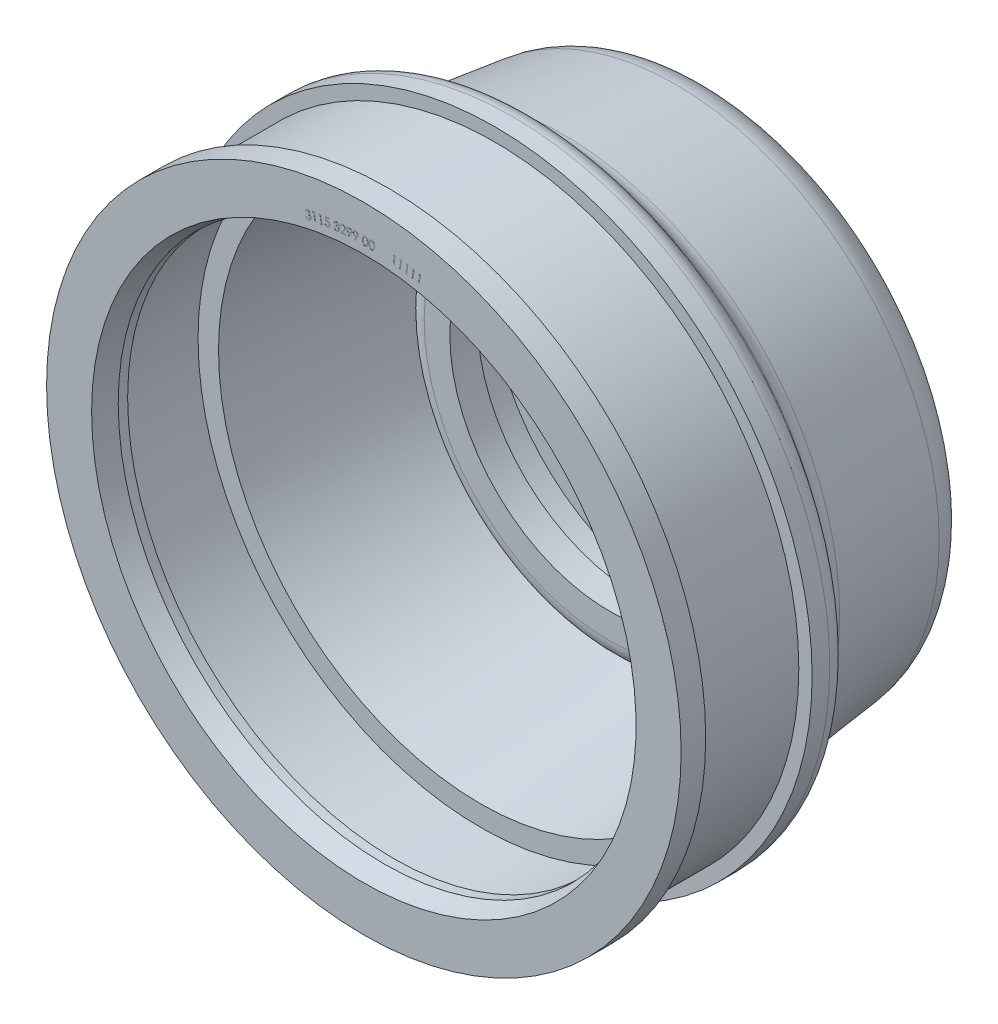
from build123d import *

# Parameters (mm, degrees)
CUT_EXTRUDE1_DEPTH = 0.01


with BuildPart() as part:
    # Sketch1 → Revolve1 (revolve)
    with BuildSketch(Plane(origin=(0, 0, 0), x_dir=(0, 0, -1), z_dir=(1, 0, 0)), mode=Mode.PRIVATE) as revolve1_sk:
        with BuildLine():
            Line((0, 39), (0, 54.394051802))
            ThreePointArc((0, 54.394051802), (-2.513674308, 61.023903054), (-8.790985526, 64.320696955))
            Line((-8.790985526, 64.320696955), (-36.478114058, 67.692847225))
            ThreePointArc((-36.478114058, 67.692847225), (-38.742988773, 68.447084113), (-40.534523991, 70.024719154))
            Line((-40.534523991, 70.024719154), (-44.699441155, 75.520095969))
            ThreePointArc((-44.699441155, 75.520095969), (-46.459484376, 76.977749426), (-48.684290003, 77.5))
            Line((-48.684290003, 77.5), (-53, 77.5))
            Line((-53, 77.5), (-53, 74.25))
            Line((-53, 74.25), (-79, 74.25))
            Line((-79, 74.25), (-79, 77.5))
            Line((-79, 77.5), (-85, 77.5))
            Line((-85, 77.5), (-85, 66.5))
            Line((-85, 66.5), (-80, 65))
            Line((-80, 65), (-77.7, 65))
            Line((-77.7, 65), (-77.7, 69))
            Line((-77.7, 69), (-56.5, 69))
            Line((-56.5, 69), (-56.5, 64))
            Line((-56.5, 64), (-12.052985352, 58.864920289))
            ThreePointArc((-12.052985352, 58.864920289), (-9.513981986, 56.283640543), (-11.498588097, 53.255294162))
            Line((-11.498588097, 53.255294162), (-21.5350139, 50.017737452))
            ThreePointArc((-21.5350139, 50.017737452), (-24.041971641, 48.20240099), (-25, 45.259194363))
            Line((-25, 45.259194363), (-25, 39))
            Line((-25, 39), (-18.3, 39))
            Line((-18.3, 39), (-18.3, 46))
            Line((-18.3, 46), (-8.2, 46))
            Line((-8.2, 46), (-8.2, 39))
            Line((-8.2, 39), (0, 39))
        make_face()
    revolve(revolve1_sk.sketch.rotate(Axis((0, 0, 0), (0, 0, 1)), 90), axis=Axis((0, 0, 0), (0, 0, 1)))

    # Sketch2 → Cut-Extrude1 (cut)
    # profile 1 of 15: a face of its own
    with BuildSketch(Plane.XY.offset(85)):
        with BuildLine():
            Line((-14.070038677, 68.536967028), (-14.269157267, 68.497303567))
            add(Edge.make_bspline(
                [(-14.269157267, 68.497303567), (-14.268217033, 68.517888074), (-14.26637414, 68.558234467), (-14.259236627, 68.617192032), (-14.247861138, 68.673247785), (-14.233204234, 68.726476158), (-14.21474788, 68.776942803), (-14.192256969, 68.824444023), (-14.165681269, 68.869007068), (-14.13563636, 68.910685567), (-14.102537905, 68.949053015), (-14.066490716, 68.983784232), (-14.028157999, 69.015069184), (-13.987041034, 69.042571359), (-13.943142971, 69.065729532), (-13.89690089, 69.085379921), (-13.848164356, 69.101679419), (-13.81437471, 69.109244233), (-13.797202139, 69.113088823)],
                knots=[0, 0, 0, 0, 1.170908619, 2.295024069, 3.371275982, 4.419129459, 5.43012897, 6.421534669, 7.401748581, 8.375002166, 9.338259363, 10.277655465, 11.216530114, 12.147021787, 13.084207398, 14.033031717, 15.000347516, 16, 16, 16, 16], degree=3))
            add(Edge.make_bspline(
                [(-13.797202139, 69.113088823), (-13.772031836, 69.117393698), (-13.722204708, 69.125915628), (-13.646496655, 69.126368418), (-13.571614446, 69.119245356), (-13.498626538, 69.10153163), (-13.428718471, 69.07702812), (-13.364620479, 69.043357094), (-13.306515138, 69.002720758), (-13.25602053, 68.954410284), (-13.212208141, 68.901663911), (-13.177712654, 68.84449306), (-13.150554539, 68.784661278), (-13.14042546, 68.742444361), (-13.135343164, 68.7212619)],
                knots=[0, 0, 0, 0, 1.075806183, 2.129665784, 3.183208981, 4.242477957, 5.290536784, 6.301210102, 7.287717869, 8.272276444, 9.241247785, 10.171891763, 11.082741347, 12, 12, 12, 12], degree=3))
            add(Edge.make_bspline(
                [(-13.135343164, 68.7212619), (-13.131959387, 68.700622745), (-13.125308999, 68.660059093), (-13.125401684, 68.59884041), (-13.134499619, 68.539452143), (-13.15121013, 68.481528016), (-13.177489478, 68.425772757), (-13.211937501, 68.371679452), (-13.254987335, 68.319449524), (-13.288688143, 68.287678091), (-13.306016241, 68.271342028)],
                knots=[0, 0, 0, 0, 0.991178882, 1.948036904, 2.889921948, 3.834361493, 4.798306442, 5.803864247, 6.870802846, 8, 8, 8, 8], degree=3))
            add(Edge.make_bspline(
                [(-13.306016241, 68.271342028), (-13.281406993, 68.265791342), (-13.232939155, 68.254859283), (-13.16383868, 68.228361552), (-13.099520396, 68.19409772), (-13.061136275, 68.16490639), (-13.041993805, 68.150348438)],
                knots=[0, 0, 0, 0, 1.030779272, 2.030116544, 3.01760328, 4, 4, 4, 4], degree=3))
            add(Edge.make_bspline(
                [(-13.041993805, 68.150348438), (-13.029259118, 68.139463358), (-13.004099632, 68.117958078), (-12.969953435, 68.08262251), (-12.939881983, 68.044976477), (-12.912682471, 68.005978309), (-12.890434137, 67.964156245), (-12.870939177, 67.920951955), (-12.855634877, 67.875418194), (-12.848486603, 67.844060996), (-12.844878421, 67.828233054)],
                knots=[0, 0, 0, 0, 1.042724602, 2.060075301, 3.053527876, 4.040661669, 5.015531578, 5.998277854, 6.989605394, 8, 8, 8, 8], degree=3))
            add(Edge.make_bspline(
                [(-12.844878421, 67.828233054), (-12.840489729, 67.800662064), (-12.831728136, 67.745619277), (-12.832631668, 67.661370611), (-12.844870059, 67.576980592), (-12.864255819, 67.507434805), (-12.884712487, 67.452900115), (-12.902988829, 67.413585502), (-12.922872388, 67.375593156), (-12.945895292, 67.339601979), (-12.971018153, 67.305065749), (-12.998901252, 67.272543997), (-13.02887619, 67.241611739), (-13.072268545, 67.203232344), (-13.131326273, 67.1601308), (-13.209296015, 67.118070195), (-13.293703452, 67.08450555), (-13.353334922, 67.070533559), (-13.3837406, 67.063409336)],
                knots=[0, 0, 0, 0, 1.284125756, 2.56363157, 3.862451106, 5.202609335, 5.880101551, 6.543455158, 7.198398646, 7.853717567, 8.509498265, 9.164037199, 9.825248231, 10.491902125, 11.830591315, 13.182136447, 14.563190635, 16, 16, 16, 16], degree=3))
            add(Edge.make_bspline(
                [(-13.3837406, 67.063409336), (-13.404390996, 67.059706478), (-13.444964815, 67.052431116), (-13.505717907, 67.047916387), (-13.564674213, 67.047638809), (-13.621968263, 67.052840578), (-13.677441707, 67.063399129), (-13.73144824, 67.078540771), (-13.783558457, 67.099130729), (-13.833971898, 67.124410845), (-13.8819649, 67.154930077), (-13.927587603, 67.190194535), (-13.969641682, 67.231204717), (-14.009579475, 67.276542826), (-14.046334302, 67.327257072), (-14.080369081, 67.382753343), (-14.111901247, 67.443057232), (-14.129783121, 67.485807491), (-14.138948934, 67.507720233)],
                knots=[0, 0, 0, 0, 1.045142002, 2.053491, 3.032043598, 3.981265106, 4.916068531, 5.843256323, 6.772854538, 7.704666736, 8.650216465, 9.603630256, 10.573472105, 11.573547216, 12.612096538, 13.691014964, 14.816470499, 16, 16, 16, 16], degree=3))
            Line((-14.138948934, 67.507720233), (-13.947843164, 67.545781131))
            add(Edge.make_bspline(
                [(-13.947843164, 67.545781131), (-13.940530618, 67.531267743), (-13.926321262, 67.503066091), (-13.902905514, 67.463514733), (-13.879454815, 67.427059371), (-13.854526117, 67.394746927), (-13.829199524, 67.365609176), (-13.803354949, 67.340006454), (-13.776629004, 67.317827187), (-13.75767073, 67.305744526), (-13.748323934, 67.299787541)],
                knots=[0, 0, 0, 0, 1.214869046, 2.360669634, 3.435331008, 4.453968487, 5.409357715, 6.320290578, 7.171870756, 8, 8, 8, 8], degree=3))
            add(Edge.make_bspline(
                [(-13.748323934, 67.299787541), (-13.736289028, 67.293263338), (-13.712340289, 67.280280568), (-13.674399266, 67.265249265), (-13.635381084, 67.253164094), (-13.594546643, 67.24643432), (-13.55251438, 67.242093456), (-13.509072109, 67.242421643), (-13.464272974, 67.2457826), (-13.434316583, 67.251295295), (-13.418997011, 67.254114464)],
                knots=[0, 0, 0, 0, 0.965045928, 1.920383362, 2.874325804, 3.840980334, 4.834806091, 5.852422248, 6.901737782, 8, 8, 8, 8], degree=3))
            add(Edge.make_bspline(
                [(-13.418997011, 67.254114464), (-13.401836341, 67.257993508), (-13.368234518, 67.265588953), (-13.320001091, 67.28115476), (-13.27533227, 67.300588653), (-13.233772318, 67.322857219), (-13.195865464, 67.349198106), (-13.161172974, 67.378835767), (-13.130311067, 67.412419729), (-13.102752698, 67.448616372), (-13.079367046, 67.487049298), (-13.059462953, 67.526135425), (-13.044612079, 67.566277552), (-13.033824523, 67.606789383), (-13.026654464, 67.647813734), (-13.025026083, 67.689474461), (-13.026657945, 67.731662145), (-13.031524068, 67.759626569), (-13.033980985, 67.773745874)],
                knots=[0, 0, 0, 0, 1.169020315, 2.289025614, 3.362478143, 4.403134348, 5.417566769, 6.424632741, 7.429584096, 8.443278395, 9.443475207, 10.416034277, 11.354160968, 12.282154581, 13.200032008, 14.115373679, 15.048447587, 16, 16, 16, 16], degree=3))
            add(Edge.make_bspline(
                [(-13.033980985, 67.773745874), (-13.038507972, 67.792348209), (-13.047524339, 67.829398336), (-13.070875514, 67.881996177), (-13.102108954, 67.930855391), (-13.14053204, 67.975515248), (-13.184781696, 68.014887946), (-13.233525949, 68.048351317), (-13.287044454, 68.073609288), (-13.334918483, 68.088688675), (-13.376284876, 68.097415248), (-13.411185233, 68.100967388), (-13.449401971, 68.103514723), (-13.49113111, 68.103792419), (-13.536282822, 68.101982232), (-13.584960439, 68.098990442), (-13.637014866, 68.093071768), (-13.672878374, 68.088309214), (-13.691432908, 68.085845233)],
                knots=[0, 0, 0, 0, 1.123859295, 2.238381966, 3.36448805, 4.522709502, 5.690525319, 6.838186276, 7.986599023, 9.156181961, 9.781364425, 10.468957554, 11.216352615, 12.03296427, 12.920758923, 13.872885468, 14.899504742, 16, 16, 16, 16], degree=3))
            Line((-13.691432908, 68.085845233), (-13.727089959, 68.264931772))
            add(Edge.make_bspline(
                [(-13.727089959, 68.264931772), (-13.705346151, 68.269864484), (-13.662626055, 68.279555793), (-13.601430349, 68.300856295), (-13.544715269, 68.327992892), (-13.492604214, 68.359150603), (-13.446705109, 68.394053847), (-13.40828229, 68.431408508), (-13.377521467, 68.470372563), (-13.355684489, 68.511524563), (-13.341009814, 68.553598414), (-13.333512104, 68.596324607), (-13.331920102, 68.639466235), (-13.336273638, 68.667744568), (-13.338468164, 68.681999079)],
                knots=[0, 0, 0, 0, 1.264615308, 2.48459182, 3.66768891, 4.827051038, 5.924492797, 6.932027578, 7.861271855, 8.72925218, 9.56331844, 10.379459918, 11.183119916, 12, 12, 12, 12], degree=3))
            add(Edge.make_bspline(
                [(-13.338468164, 68.681999079), (-13.34092122, 68.692345826), (-13.345774238, 68.712815379), (-13.35680782, 68.742177015), (-13.37039358, 68.770105119), (-13.387305416, 68.796118147), (-13.40714984, 68.820473165), (-13.430158062, 68.842836022), (-13.455804596, 68.863761108), (-13.484182311, 68.882443756), (-13.514503551, 68.898731165), (-13.546119938, 68.912621653), (-13.579130913, 68.922474678), (-13.613050687, 68.929409122), (-13.64807305, 68.932933998), (-13.684289183, 68.933418446), (-13.721530816, 68.930045958), (-13.746480096, 68.925760422), (-13.759141241, 68.923585618)],
                knots=[0, 0, 0, 0, 0.94465197, 1.868858263, 2.782245779, 3.701173691, 4.621021758, 5.56984374, 6.549015192, 7.560066721, 8.5854503, 9.606700363, 10.624631527, 11.642285627, 12.680853788, 13.749597574, 14.857976204, 16, 16, 16, 16], degree=3))
            add(Edge.make_bspline(
                [(-13.759141241, 68.923585618), (-13.779413329, 68.918833805), (-13.818933592, 68.909570186), (-13.873284181, 68.883691899), (-13.922275166, 68.851291083), (-13.957173007, 68.816738829), (-13.981865947, 68.785127893), (-13.998993899, 68.758284043), (-14.014628804, 68.728516341), (-14.028611721, 68.695762465), (-14.041409608, 68.660204487), (-14.052567582, 68.62165262), (-14.062124648, 68.580288785), (-14.067350845, 68.551680344), (-14.070038677, 68.536967028)],
                knots=[0, 0, 0, 0, 1.40067502, 2.730604159, 4.034690223, 5.346808379, 6.02068115, 6.737775618, 7.491228662, 8.286027923, 9.137931472, 10.038673143, 10.991289971, 12, 12, 12, 12], degree=3))
        make_face()
    # profile 2 of 15: a face of its own
    with BuildSketch(Plane.XY.offset(85)):
        Polygon((-12.462572135, 69.307231697), (-12.078758032, 69.37494003), (-11.734607391, 67.422616312), (-11.928517647, 67.388561825), (-12.239014442, 69.149779774), (-12.545504827, 69.095693235), align=None)
    # profile 3 of 15: a face of its own
    with BuildSketch(Plane.XY.offset(85)):
        Polygon((-10.901382628, 69.581336231), (-10.513962756, 69.640631102), (-10.212280064, 67.669877897), (-10.408193525, 67.63982982), (-10.680228782, 69.417474051), (-10.989523654, 69.37019841), align=None)
    # profile 4 of 15: a face of its own
    with BuildSketch(Plane.XY.offset(85)):
        with BuildLine():
            Line((-8.493299056, 69.911335144), (-8.468859954, 69.723835144))
            Line((-8.468859954, 69.723835144), (-9.170783031, 69.632889632))
            Line((-9.170783031, 69.632889632), (-9.198827902, 69.082809503))
            add(Edge.make_bspline(
                [(-9.198827902, 69.082809503), (-9.178753833, 69.091191227), (-9.139813698, 69.107450284), (-9.081825829, 69.127182462), (-9.026215326, 69.141542172), (-8.98974653, 69.14731723), (-8.972065082, 69.150117196)],
                knots=[0, 0, 0, 0, 1.099876355, 2.133565128, 3.095081961, 4, 4, 4, 4], degree=3))
            add(Edge.make_bspline(
                [(-8.972065082, 69.150117196), (-8.950055977, 69.152360677), (-8.906781121, 69.156771866), (-8.842347135, 69.156883564), (-8.780259999, 69.150320566), (-8.720268717, 69.138483459), (-8.66270556, 69.1198096), (-8.607340275, 69.095241087), (-8.553941948, 69.065127604), (-8.503884274, 69.028607049), (-8.457065847, 68.987568431), (-8.414881371, 68.942214317), (-8.377752478, 68.892908654), (-8.345521826, 68.839832169), (-8.318670495, 68.782708096), (-8.297113811, 68.721730486), (-8.279939103, 68.657048235), (-8.273187324, 68.612139958), (-8.269741364, 68.58921976)],
                knots=[0, 0, 0, 0, 1.053365692, 2.071154117, 3.062375836, 4.022976851, 4.978530761, 5.938310002, 6.904057449, 7.892744907, 8.88431356, 9.865544544, 10.837535821, 11.81938519, 12.818171113, 13.838282692, 14.89670696, 16, 16, 16, 16], degree=3))
            add(Edge.make_bspline(
                [(-8.269741364, 68.58921976), (-8.267952358, 68.573210491), (-8.264396501, 68.541390216), (-8.262387424, 68.493610958), (-8.263643317, 68.446510182), (-8.267689273, 68.40009024), (-8.274392525, 68.354277303), (-8.284509432, 68.309082004), (-8.297337903, 68.264523541), (-8.312909444, 68.220862086), (-8.331252434, 68.17877281), (-8.35171132, 68.138412798), (-8.374616429, 68.100266622), (-8.399880218, 68.064085409), (-8.42763772, 68.03010799), (-8.457196223, 67.99783107), (-8.489510154, 67.968146926), (-8.52387562, 67.940525468), (-8.560433059, 67.915230422), (-8.598910003, 67.892444663), (-8.639072248, 67.872021017), (-8.680941871, 67.853682849), (-8.725008933, 67.838733018), (-8.770750025, 67.825924371), (-8.818178699, 67.815229882), (-8.850630975, 67.810679332), (-8.867097133, 67.808370401)],
                knots=[0, 0, 0, 0, 1.052658877, 2.092281454, 3.122591757, 4.130171281, 5.136237354, 6.146422252, 7.15475765, 8.165244186, 9.173844005, 10.15366836, 11.120695769, 12.079613542, 13.035228328, 13.986447991, 14.937667653, 15.900075006, 16.866156513, 17.840679002, 18.820503357, 19.80961462, 20.825440322, 21.858962335, 22.913645836, 24, 24, 24, 24], degree=3))
            add(Edge.make_bspline(
                [(-8.867097133, 67.808370401), (-8.886841071, 67.80634062), (-8.92559061, 67.802356964), (-8.983229108, 67.801484571), (-9.039065082, 67.805744144), (-9.093010401, 67.815674792), (-9.145465182, 67.829476497), (-9.195996362, 67.848871408), (-9.244782973, 67.873089121), (-9.291376845, 67.901875374), (-9.335472791, 67.934446677), (-9.375406606, 67.971245068), (-9.412427463, 68.010461135), (-9.444531001, 68.053795543), (-9.474406541, 68.099349085), (-9.498785737, 68.149000743), (-9.520529729, 68.201348052), (-9.531420581, 68.238010179), (-9.536968928, 68.256687708)],
                knots=[0, 0, 0, 0, 1.07625471, 2.112262194, 3.122340056, 4.108495847, 5.083762537, 6.060507821, 7.038890386, 8.034077751, 9.027972373, 10.00742708, 10.976215314, 11.948383131, 12.92901584, 13.926836259, 14.943826249, 16, 16, 16, 16], degree=3))
            Line((-9.536968928, 68.256687708), (-9.335045851, 68.283130016))
            add(Edge.make_bspline(
                [(-9.335045851, 68.283130016), (-9.328580603, 68.265491679), (-9.316088996, 68.231412375), (-9.292374573, 68.184353094), (-9.265560448, 68.143044246), (-9.234990029, 68.107433945), (-9.200566641, 68.07721885), (-9.162273479, 68.051266641), (-9.120063911, 68.029234546), (-9.07425106, 68.011439588), (-9.026243671, 67.998052666), (-8.977113315, 67.991156505), (-8.927788988, 67.988644165), (-8.89512788, 67.991853745), (-8.878715723, 67.993466555)],
                knots=[0, 0, 0, 0, 1.146178367, 2.214548916, 3.209559853, 4.146096982, 5.070344565, 5.99753642, 6.963976476, 7.97084249, 8.993431501, 9.998910054, 10.994455333, 12, 12, 12, 12], degree=3))
            add(Edge.make_bspline(
                [(-8.878715723, 67.993466555), (-8.862887742, 67.995939311), (-8.831550108, 68.000835091), (-8.786197005, 68.013906919), (-8.74290061, 68.030993695), (-8.702577283, 68.053427674), (-8.663921013, 68.079016653), (-8.628251042, 68.109782089), (-8.594887974, 68.144946882), (-8.563972386, 68.183769712), (-8.536364366, 68.22568031), (-8.513057248, 68.269781615), (-8.494397609, 68.31579393), (-8.480936246, 68.363673222), (-8.471558519, 68.413128855), (-8.467253409, 68.464258946), (-8.467631201, 68.51709935), (-8.471362718, 68.5526486), (-8.473267005, 68.570790273)],
                knots=[0, 0, 0, 0, 0.97764131, 1.935620549, 2.876252862, 3.814335263, 4.748686569, 5.703326194, 6.684127058, 7.705796772, 8.730652608, 9.745002179, 10.747740706, 11.757257587, 12.777949969, 13.817758586, 14.886347534, 16, 16, 16, 16], degree=3))
            add(Edge.make_bspline(
                [(-8.473267005, 68.570790273), (-8.475831464, 68.586992957), (-8.480852256, 68.618715167), (-8.492288343, 68.664603803), (-8.508228906, 68.707406257), (-8.527231315, 68.747567157), (-8.550461616, 68.784726783), (-8.576758772, 68.819328866), (-8.607164517, 68.850729496), (-8.640682795, 68.879103955), (-8.677188077, 68.903971765), (-8.716083963, 68.92491796), (-8.757280965, 68.941309208), (-8.800308545, 68.953866377), (-8.84557567, 68.9619039), (-8.892935866, 68.965231099), (-8.94255024, 68.965081916), (-8.97609269, 68.961334427), (-8.993299056, 68.959412067)],
                knots=[0, 0, 0, 0, 1.076492463, 2.107596521, 3.0976435, 4.069953353, 5.018624292, 5.968873283, 6.917382222, 7.88147841, 8.846689713, 9.811423267, 10.775041154, 11.751530291, 12.748807232, 13.786151907, 14.864356033, 16, 16, 16, 16], degree=3))
            add(Edge.make_bspline(
                [(-8.993299056, 68.959412067), (-9.008171303, 68.957259102), (-9.038825918, 68.95282142), (-9.08509726, 68.941059034), (-9.133528942, 68.926844524), (-9.183438177, 68.907992445), (-9.235775643, 68.886562782), (-9.289537243, 68.860652308), (-9.345611213, 68.83192472), (-9.382819412, 68.810283946), (-9.401952902, 68.799155657)],
                knots=[0, 0, 0, 0, 0.815828029, 1.681581417, 2.590518245, 3.556854454, 4.578140039, 5.662057041, 6.797764711, 8, 8, 8, 8], degree=3))
            Line((-9.401952902, 68.799155657), (-9.346664441, 69.800758221))
            Line((-9.346664441, 69.800758221), (-8.493299056, 69.911335144))
        make_face()
    # profile 5 of 15: a face of its own
    with BuildSketch(Plane.XY.offset(85)):
        with BuildLine():
            Line((-7.075605425, 69.613577334), (-7.278730425, 69.593945923))
            add(Edge.make_bspline(
                [(-7.278730425, 69.593945923), (-7.275814454, 69.614428868), (-7.270098555, 69.654579629), (-7.256806677, 69.712704847), (-7.23990748, 69.767602904), (-7.219580942, 69.819197038), (-7.19574904, 69.867706694), (-7.168685801, 69.913084178), (-7.1375345, 69.954828962), (-7.103567315, 69.993525834), (-7.066169887, 70.028080979), (-7.027107872, 70.05962903), (-6.985311441, 70.086509811), (-6.941706703, 70.110090889), (-6.895404292, 70.128522327), (-6.847503022, 70.144201958), (-6.797096491, 70.154887411), (-6.762608717, 70.15910803), (-6.745076579, 70.161253616)],
                knots=[0, 0, 0, 0, 1.171006418, 2.295412191, 3.371652204, 4.420504948, 5.431584473, 6.428771597, 7.407206621, 8.376719379, 9.339634623, 10.286685268, 11.215756739, 12.149340155, 13.088692798, 14.033234855, 15.000179051, 16, 16, 16, 16], degree=3))
            add(Edge.make_bspline(
                [(-6.745076579, 70.161253616), (-6.719435669, 70.163034362), (-6.668752067, 70.166554309), (-6.593127751, 70.159347398), (-6.519127058, 70.144444012), (-6.44805394, 70.119344091), (-6.380963979, 70.087440191), (-6.320090286, 70.047809095), (-6.266364045, 70.001055403), (-6.220522508, 69.947749387), (-6.182587878, 69.890282229), (-6.152884667, 69.830113888), (-6.132118964, 69.767386095), (-6.126229767, 69.724158729), (-6.123281707, 69.702519641)],
                knots=[0, 0, 0, 0, 1.078213538, 2.131271771, 3.179956222, 4.242834086, 5.289294708, 6.294619657, 7.284815399, 8.271332205, 9.239277129, 10.170234924, 11.08404214, 12, 12, 12, 12], degree=3))
            add(Edge.make_bspline(
                [(-6.123281707, 69.702519641), (-6.121993149, 69.681546517), (-6.11945897, 69.640299146), (-6.126372095, 69.579340554), (-6.140586953, 69.520753089), (-6.164407002, 69.465104508), (-6.195855628, 69.411854777), (-6.235767171, 69.361275714), (-6.284011801, 69.313453895), (-6.320992168, 69.285182067), (-6.340028502, 69.270628616)],
                knots=[0, 0, 0, 0, 0.991431919, 1.949826869, 2.886676906, 3.831487305, 4.799210071, 5.801730278, 6.868399641, 8, 8, 8, 8], degree=3))
            add(Edge.make_bspline(
                [(-6.340028502, 69.270628616), (-6.31586075, 69.26272605), (-6.268324965, 69.247182417), (-6.202324986, 69.213024383), (-6.141202827, 69.172935238), (-6.106011411, 69.139767127), (-6.088425938, 69.123192718)],
                knots=[0, 0, 0, 0, 1.034033518, 2.033850549, 3.017497127, 4, 4, 4, 4], degree=3))
            add(Edge.make_bspline(
                [(-6.088425938, 69.123192718), (-6.0766935, 69.110989056), (-6.053604271, 69.086972464), (-6.023605542, 69.047603893), (-5.997084769, 69.007248891), (-5.974286324, 68.965267391), (-5.956140434, 68.921499837), (-5.940868002, 68.876398171), (-5.930637235, 68.829451461), (-5.926595762, 68.797507143), (-5.924563758, 68.781445923)],
                knots=[0, 0, 0, 0, 1.049704657, 2.065800175, 3.065646384, 4.044494923, 5.024920752, 6.002400247, 6.995630818, 8, 8, 8, 8], degree=3))
            add(Edge.make_bspline(
                [(-5.924563758, 68.781445923), (-5.922965658, 68.753392674), (-5.919776497, 68.697409756), (-5.929293312, 68.613400696), (-5.949426145, 68.530264947), (-5.975961472, 68.462958445), (-6.00157789, 68.410435627), (-6.023984925, 68.373087881), (-6.047863524, 68.337264097), (-6.074405081, 68.303527553), (-6.103327302, 68.271935969), (-6.134241604, 68.242066403), (-6.167580835, 68.214524055), (-6.214574686, 68.180218234), (-6.278249411, 68.143412552), (-6.360285964, 68.10880837), (-6.44814255, 68.084383361), (-6.508964474, 68.076385552), (-6.539948374, 68.072311308)],
                knots=[0, 0, 0, 0, 1.287331323, 2.568991684, 3.861983616, 5.2024829, 5.879359283, 6.541428957, 7.199145763, 7.853743851, 8.508714676, 9.163111972, 9.824500737, 10.491260989, 11.831255989, 13.187834907, 14.567427051, 16, 16, 16, 16], degree=3))
            add(Edge.make_bspline(
                [(-6.539948374, 68.072311308), (-6.560902532, 68.070768752), (-6.602114214, 68.067734923), (-6.663233104, 68.069092983), (-6.722191813, 68.075021225), (-6.779023927, 68.085640668), (-6.833291277, 68.102062207), (-6.885727968, 68.122208134), (-6.935566109, 68.148268852), (-6.983359682, 68.178575523), (-7.028186876, 68.214007164), (-7.070327142, 68.253735811), (-7.108216254, 68.298987542), (-7.143169478, 68.348441036), (-7.175080086, 68.402509236), (-7.20319368, 68.461494575), (-7.228831003, 68.524927777), (-7.242226316, 68.569518604), (-7.249082989, 68.592343359)],
                knots=[0, 0, 0, 0, 1.042903467, 2.051134853, 3.031073095, 3.983147849, 4.916915127, 5.843020693, 6.768437396, 7.704838587, 8.6494467, 9.601683122, 10.575656437, 11.574795294, 12.606398814, 13.689030316, 14.81708145, 16, 16, 16, 16], degree=3))
            Line((-7.249082989, 68.592343359), (-7.054371451, 68.611173488))
            add(Edge.make_bspline(
                [(-7.054371451, 68.611173488), (-7.048524972, 68.596014607), (-7.037129038, 68.566466976), (-7.017821872, 68.524559347), (-6.997942706, 68.485866282), (-6.976590534, 68.450832166), (-6.95425769, 68.41921405), (-6.930985218, 68.390939767), (-6.906604305, 68.366151903), (-6.888795976, 68.352312263), (-6.880092605, 68.345548488)],
                knots=[0, 0, 0, 0, 1.210758467, 2.360005765, 3.437473786, 4.451552206, 5.4154848, 6.320404122, 7.179139866, 8, 8, 8, 8], degree=3))
            add(Edge.make_bspline(
                [(-6.880092605, 68.345548488), (-6.868734289, 68.337866834), (-6.84608689, 68.322550348), (-6.80995749, 68.303265894), (-6.771813727, 68.287820924), (-6.7318374, 68.276562691), (-6.690260622, 68.267743363), (-6.64688703, 68.263658872), (-6.60172937, 68.262685713), (-6.571189256, 68.265025286), (-6.555573374, 68.266221565)],
                knots=[0, 0, 0, 0, 0.96244433, 1.919022278, 2.869882655, 3.846343572, 4.832171988, 5.85025921, 6.900786764, 8, 8, 8, 8], degree=3))
            add(Edge.make_bspline(
                [(-6.555573374, 68.266221565), (-6.538036475, 68.268350461), (-6.503668946, 68.272522515), (-6.453868827, 68.283311166), (-6.407219372, 68.298163862), (-6.363646529, 68.316721015), (-6.322920365, 68.338679637), (-6.285400563, 68.364878337), (-6.251248741, 68.395223912), (-6.220200916, 68.42870045), (-6.192704519, 68.464516202), (-6.169325438, 68.501814965), (-6.150492279, 68.540332433), (-6.134895805, 68.579409862), (-6.124694136, 68.619862293), (-6.118070398, 68.661010995), (-6.116074036, 68.703343234), (-6.11793241, 68.731774235), (-6.118874656, 68.746189513)],
                knots=[0, 0, 0, 0, 1.16976075, 2.292411295, 3.369525065, 4.407982824, 5.42535179, 6.429091207, 7.431894591, 8.445950522, 9.449183029, 10.418777131, 11.356407007, 12.286242371, 13.200289333, 14.113651102, 15.043570625, 16, 16, 16, 16], degree=3))
            add(Edge.make_bspline(
                [(-6.118874656, 68.746189513), (-6.121491531, 68.765277635), (-6.126688494, 68.803185551), (-6.14492871, 68.857852354), (-6.170922207, 68.909717584), (-6.204433689, 68.958201245), (-6.244366515, 69.002223061), (-6.289810475, 69.040202563), (-6.340622612, 69.071056737), (-6.387065859, 69.090530745), (-6.427487948, 69.103647891), (-6.461950546, 69.11073769), (-6.499855188, 69.11734689), (-6.541451363, 69.122119033), (-6.586796534, 69.124601255), (-6.635819217, 69.126325521), (-6.688467631, 69.126282834), (-6.724780082, 69.125036344), (-6.743474015, 69.124394641)],
                knots=[0, 0, 0, 0, 1.12708475, 2.238325688, 3.358323498, 4.517555893, 5.681007528, 6.83135577, 7.976260187, 9.150845584, 9.774591108, 10.46387653, 11.210122349, 12.029449741, 12.915508109, 13.870820325, 14.903881712, 16, 16, 16, 16], degree=3))
            Line((-6.743474015, 69.124394641), (-6.76110222, 69.306686308))
            add(Edge.make_bspline(
                [(-6.76110222, 69.306686308), (-6.73886074, 69.309458569), (-6.695198967, 69.314900736), (-6.632098547, 69.330294435), (-6.572668222, 69.351291138), (-6.517475239, 69.377266808), (-6.468222147, 69.407937157), (-6.425644021, 69.440906019), (-6.391347682, 69.476913512), (-6.3652232, 69.51548175), (-6.346946213, 69.556060578), (-6.33394734, 69.597552914), (-6.32882102, 69.640580169), (-6.330146993, 69.669265235), (-6.330813758, 69.683689513)],
                knots=[0, 0, 0, 0, 1.26725816, 2.48772729, 3.665832473, 4.828426612, 5.931248967, 6.942504887, 7.86715453, 8.73261704, 9.564274379, 10.376976646, 11.183863122, 12, 12, 12, 12], degree=3))
            add(Edge.make_bspline(
                [(-6.330813758, 69.683689513), (-6.332217703, 69.694273645), (-6.334998055, 69.715234324), (-6.342601967, 69.74578742), (-6.353565816, 69.774916269), (-6.367584621, 69.802649875), (-6.384947309, 69.828850215), (-6.405633465, 69.853448108), (-6.429412701, 69.876583287), (-6.455577369, 69.898599319), (-6.484185511, 69.918031963), (-6.514542092, 69.934591144), (-6.546269511, 69.948309958), (-6.579535552, 69.958814095), (-6.614385962, 69.965474451), (-6.650416414, 69.969378672), (-6.687960298, 69.970924968), (-6.713300707, 69.968819585), (-6.726246451, 69.967744)],
                knots=[0, 0, 0, 0, 0.945211611, 1.87188493, 2.781489298, 3.696691283, 4.618595902, 5.559132811, 6.537800665, 7.554063866, 8.584275357, 9.595362135, 10.612726231, 11.641578604, 12.678558969, 13.749721871, 14.850392527, 16, 16, 16, 16], degree=3))
            add(Edge.make_bspline(
                [(-6.726246451, 69.967744), (-6.746960815, 69.964968897), (-6.787430206, 69.959547212), (-6.844569809, 69.939793676), (-6.896451994, 69.911706227), (-6.935093371, 69.881251358), (-6.962951743, 69.852172743), (-6.983061954, 69.827424086), (-7.001313509, 69.799154538), (-7.01869105, 69.767965873), (-7.034953346, 69.733867736), (-7.049772876, 69.696438536), (-7.063901174, 69.65630276), (-7.071639671, 69.628054), (-7.075605425, 69.613577334)],
                knots=[0, 0, 0, 0, 1.402213365, 2.73948648, 4.037142592, 5.35379221, 6.026859607, 6.741968179, 7.493998215, 8.285814385, 9.141199255, 10.031493193, 10.991197639, 12, 12, 12, 12], degree=3))
        make_face()
    # profile 6 of 15: a face of its own
    with BuildSketch(Plane.XY.offset(85)):
        with BuildLine():
            Line((-5.544386813, 69.586396338), (-5.735091941, 69.572373902))
            add(Edge.make_bspline(
                [(-5.735091941, 69.572373902), (-5.735615547, 69.596549125), (-5.736641019, 69.643895846), (-5.731531941, 69.713695197), (-5.719655253, 69.780536936), (-5.702676691, 69.844602154), (-5.679562137, 69.905799571), (-5.650628614, 69.964074378), (-5.615708131, 70.019611517), (-5.574746051, 70.071312046), (-5.530009847, 70.119246796), (-5.481173786, 70.161546445), (-5.429268125, 70.1982517), (-5.374071183, 70.229215885), (-5.315749287, 70.254689865), (-5.254025975, 70.273758138), (-5.189258517, 70.287685924), (-5.144743126, 70.292089977), (-5.122111172, 70.294329031)],
                knots=[0, 0, 0, 0, 1.099658356, 2.153660257, 3.177445361, 4.183996487, 5.164561604, 6.14811468, 7.139219281, 8.143108322, 9.144512507, 10.117823594, 11.076923882, 12.031704224, 12.99218894, 13.966390791, 14.966098055, 16, 16, 16, 16], degree=3))
            add(Edge.make_bspline(
                [(-5.122111172, 70.294329031), (-5.099680258, 70.295567212), (-5.055866431, 70.297985724), (-4.991171884, 70.294177881), (-4.929448441, 70.284664317), (-4.870520077, 70.269353193), (-4.814408129, 70.248522584), (-4.76138646, 70.221531984), (-4.711186105, 70.188707504), (-4.664451613, 70.150439513), (-4.621582994, 70.108424002), (-4.583448566, 70.063517038), (-4.550639044, 70.016255357), (-4.522604854, 69.966601311), (-4.500216051, 69.91442416), (-4.483057813, 69.859902735), (-4.470122249, 69.803256859), (-4.466495187, 69.764345573), (-4.464659249, 69.744649543)],
                knots=[0, 0, 0, 0, 1.125950595, 2.199295309, 3.243209718, 4.25367032, 5.247681376, 6.239161872, 7.231185174, 8.250046162, 9.263609743, 10.237837052, 11.200273922, 12.144879808, 13.092946235, 14.041911282, 15.008858908, 16, 16, 16, 16], degree=3))
            add(Edge.make_bspline(
                [(-4.464659249, 69.744649543), (-4.463509019, 69.716721978), (-4.461229079, 69.661365089), (-4.47102712, 69.578911573), (-4.490704322, 69.49839723), (-4.516371351, 69.432791705), (-4.542283897, 69.37911745), (-4.567211653, 69.335461257), (-4.595902339, 69.287710253), (-4.62975566, 69.236604868), (-4.667823511, 69.181703625), (-4.710388186, 69.123262322), (-4.757231718, 69.061018214), (-4.790682907, 69.018878976), (-4.808008608, 68.99705339)],
                knots=[0, 0, 0, 0, 1.190140617, 2.35904849, 3.525971598, 4.715567279, 5.354752894, 6.065962136, 6.857900937, 7.729639099, 8.678893854, 9.706191028, 10.811945114, 12, 12, 12, 12], degree=3))
            Line((-4.808008608, 68.99705339), (-5.263537454, 68.426540569))
            Line((-5.263537454, 68.426540569), (-4.345268224, 68.494248902))
            Line((-4.345268224, 68.494248902), (-4.331245788, 68.302341851))
            Line((-4.331245788, 68.302341851), (-5.682207326, 68.202982877))
            Line((-5.682207326, 68.202982877), (-4.982287454, 69.079585441))
            add(Edge.make_bspline(
                [(-4.982287454, 69.079585441), (-4.965291259, 69.100924388), (-4.932700775, 69.141842172), (-4.886350205, 69.201201936), (-4.845182512, 69.256445199), (-4.808591012, 69.307252179), (-4.776994817, 69.353867435), (-4.749475595, 69.395623106), (-4.727467178, 69.433505693), (-4.703825653, 69.477332178), (-4.681795426, 69.530514777), (-4.664538085, 69.594877709), (-4.65547028, 69.660269413), (-4.656999682, 69.703896372), (-4.657768224, 69.725819415)],
                knots=[0, 0, 0, 0, 1.32475141, 2.540232747, 3.6569667, 4.670176289, 5.580331467, 6.391588915, 7.097867526, 7.707085571, 8.809053303, 9.883484637, 10.936426953, 12, 12, 12, 12], degree=3))
            add(Edge.make_bspline(
                [(-4.657768224, 69.725819415), (-4.659065156, 69.739619419), (-4.661618276, 69.766785899), (-4.670694996, 69.80639513), (-4.683496741, 69.844104747), (-4.700113269, 69.880032968), (-4.720216351, 69.914369118), (-4.744352735, 69.946786457), (-4.772271105, 69.977505723), (-4.803653744, 70.005908586), (-4.837378967, 70.031916945), (-4.873203061, 70.054124128), (-4.910652282, 70.072048831), (-4.949414161, 70.086834578), (-4.989767812, 70.097045208), (-5.031607981, 70.103587141), (-5.07482683, 70.105947846), (-5.104085106, 70.104671224), (-5.118906044, 70.104024543)],
                knots=[0, 0, 0, 0, 1.002151934, 1.972821208, 2.932458692, 3.879457858, 4.832503173, 5.806678153, 6.798713704, 7.831705447, 8.865826761, 9.876932249, 10.875396098, 11.866254102, 12.874167713, 13.881525183, 14.92687507, 16, 16, 16, 16], degree=3))
            add(Edge.make_bspline(
                [(-5.118906044, 70.104024543), (-5.134439416, 70.102440314), (-5.164912838, 70.099332368), (-5.209263443, 70.089862372), (-5.251503409, 70.07723871), (-5.291416412, 70.060322495), (-5.328780701, 70.039335556), (-5.364001164, 70.014698194), (-5.396783986, 69.986141527), (-5.427409228, 69.954181224), (-5.454445991, 69.918347321), (-5.478724559, 69.879943639), (-5.498830759, 69.83822095), (-5.51513342, 69.793461928), (-5.528453955, 69.745961182), (-5.537507066, 69.695380881), (-5.54323596, 69.641950393), (-5.543996413, 69.605241777), (-5.544386813, 69.586396338)],
                knots=[0, 0, 0, 0, 1.004229299, 1.970100528, 2.913531761, 3.837820298, 4.753598004, 5.666831262, 6.599077659, 7.547467881, 8.510121574, 9.483117445, 10.467172801, 11.484193483, 12.545570478, 13.637953111, 14.787374357, 16, 16, 16, 16], degree=3))
        make_face()
    # profile 7 of 15: a face of its own
    with BuildSketch(Plane.XY.offset(85)):
        with BuildLine():
            Line((-3.69711623, 68.286059162), (-3.865786102, 68.383414931))
            Line((-3.865786102, 68.383414931), (-3.370193153, 69.224360444))
            add(Edge.make_bspline(
                [(-3.370193153, 69.224360444), (-3.387607143, 69.218103627), (-3.421549911, 69.205908048), (-3.472673793, 69.192155571), (-3.522440862, 69.183227788), (-3.555260456, 69.180447871), (-3.571314948, 69.179088008)],
                knots=[0, 0, 0, 0, 1.07266536, 2.090803549, 3.066070769, 4, 4, 4, 4], degree=3))
            add(Edge.make_bspline(
                [(-3.571314948, 69.179088008), (-3.590686302, 69.178555569), (-3.62897407, 69.177503195), (-3.685531874, 69.182865933), (-3.739984753, 69.19378473), (-3.792556017, 69.209832125), (-3.843077031, 69.23166368), (-3.891867745, 69.258465533), (-3.938210577, 69.291440774), (-3.982186318, 69.329119068), (-4.022906909, 69.37079311), (-4.058598262, 69.415948506), (-4.089871519, 69.463535418), (-4.115835483, 69.514051464), (-4.136908712, 69.567301818), (-4.152328963, 69.623349337), (-4.163523723, 69.682034053), (-4.166404452, 69.722308521), (-4.167869435, 69.742789931)],
                knots=[0, 0, 0, 0, 1.01626345, 2.008659815, 2.973551168, 3.926816591, 4.887575628, 5.856936446, 6.842777679, 7.866745312, 8.892701768, 9.895315967, 10.882824934, 11.876482647, 12.870807485, 13.882614468, 14.923212566, 16, 16, 16, 16], degree=3))
            add(Edge.make_bspline(
                [(-4.167869435, 69.742789931), (-4.16837397, 69.77073808), (-4.169368389, 69.825822891), (-4.157545569, 69.906613898), (-4.136763678, 69.983907315), (-4.105426665, 70.056862468), (-4.064414845, 70.124680339), (-4.014680833, 70.186642965), (-3.956075543, 70.241969132), (-3.889214951, 70.289498497), (-3.816969739, 70.32965271), (-3.740203506, 70.359248079), (-3.660422992, 70.379707109), (-3.605753201, 70.384565509), (-3.578125846, 70.3870207)],
                knots=[0, 0, 0, 0, 1.033105771, 2.03621483, 3.009896211, 3.988633111, 4.964332331, 5.934670698, 6.920694537, 7.937159294, 8.963610091, 9.971469534, 10.974882999, 12, 12, 12, 12], degree=3))
            add(Edge.make_bspline(
                [(-3.578125846, 70.3870207), (-3.551113054, 70.387512095), (-3.497625024, 70.388485105), (-3.418525428, 70.376635875), (-3.342046295, 70.355297469), (-3.268917979, 70.32403968), (-3.200362427, 70.283846179), (-3.138477934, 70.234320949), (-3.083452538, 70.176714239), (-3.037146623, 70.110999611), (-2.998708568, 70.040425889), (-2.96951699, 69.966081548), (-2.950226422, 69.888576001), (-2.94549255, 69.835573696), (-2.94310982, 69.8088957)],
                knots=[0, 0, 0, 0, 1.016297556, 2.012370765, 2.999894927, 4.000695887, 4.999838979, 5.9843213, 6.977149444, 7.990666359, 9.003683696, 9.997722024, 10.992180387, 12, 12, 12, 12], degree=3))
            add(Edge.make_bspline(
                [(-2.94310982, 69.8088957), (-2.94270876, 69.788052694), (-2.941894553, 69.745738507), (-2.948223468, 69.681307048), (-2.961028302, 69.615377107), (-2.975907595, 69.559245719), (-2.991144273, 69.512788895), (-3.005351205, 69.475830668), (-3.021699629, 69.437040065), (-3.040790055, 69.396405327), (-3.061822829, 69.353891339), (-3.085171991, 69.309447249), (-3.111345516, 69.263582423), (-3.12964374, 69.232354724), (-3.139023282, 69.216347623)],
                knots=[0, 0, 0, 0, 1.184004092, 2.403692146, 3.670456334, 4.997820066, 5.701052277, 6.44813395, 7.247405544, 8.092907264, 8.999177904, 9.942998663, 10.945595479, 12, 12, 12, 12], degree=3))
            Line((-3.139023282, 69.216347623), (-3.69711623, 68.286059162))
        make_face()
        with BuildLine():
            add(Edge.make_bspline(
                [(-3.534455974, 69.356171341), (-3.520128769, 69.357198939), (-3.491944169, 69.359220438), (-3.450909004, 69.367496054), (-3.41164578, 69.379238452), (-3.374083782, 69.394266503), (-3.338369702, 69.413372237), (-3.304731005, 69.43627833), (-3.272789445, 69.462981258), (-3.243185788, 69.493182041), (-3.216118144, 69.525659362), (-3.192624359, 69.559918002), (-3.173229114, 69.595757306), (-3.158116794, 69.633198382), (-3.146300196, 69.671766192), (-3.138724619, 69.711786519), (-3.134964729, 69.753140059), (-3.13579731, 69.781112968), (-3.136218794, 69.795273905)],
                knots=[0, 0, 0, 0, 1.044288505, 2.054333206, 3.038140956, 4.023387373, 4.992837136, 5.979280839, 6.979602732, 8.017178403, 9.052339567, 10.052283802, 11.034891054, 12.011135202, 12.985636747, 13.965212219, 14.96991397, 16, 16, 16, 16], degree=3))
            add(Edge.make_bspline(
                [(-3.136218794, 69.795273905), (-3.137287684, 69.809460505), (-3.139388327, 69.837340824), (-3.147088682, 69.87818471), (-3.158820296, 69.917183965), (-3.17402932, 69.95452327), (-3.192886128, 69.990113539), (-3.216066468, 70.023433094), (-3.242605234, 70.055355806), (-3.272846671, 70.084919463), (-3.305343873, 70.112148906), (-3.339915403, 70.135380294), (-3.375792035, 70.154917933), (-3.4132502, 70.170000348), (-3.451934436, 70.181886788), (-3.492240282, 70.189392483), (-3.533988694, 70.193165054), (-3.562228597, 70.192330807), (-3.576523282, 70.191908521)],
                knots=[0, 0, 0, 0, 1.034684485, 2.033421394, 3.017296451, 3.993607389, 4.963123478, 5.941608453, 6.941998784, 7.979645441, 9.014877426, 10.022932254, 11.005606731, 11.981917669, 12.956485885, 13.945673921, 14.9601259, 16, 16, 16, 16], degree=3))
            add(Edge.make_bspline(
                [(-3.576523282, 70.191908521), (-3.590719504, 70.190887194), (-3.618644013, 70.188878206), (-3.659374729, 70.180488795), (-3.698353513, 70.169050511), (-3.735536004, 70.153473676), (-3.771300038, 70.134979347), (-3.804679803, 70.111645983), (-3.836579922, 70.085104675), (-3.866217226, 70.055025948), (-3.892824445, 70.022284081), (-3.916372994, 69.988179077), (-3.935740835, 69.952318013), (-3.950862647, 69.914882683), (-3.962668356, 69.876313378), (-3.970278476, 69.836293305), (-3.973906754, 69.794940902), (-3.97340958, 69.766967057), (-3.973157897, 69.752805957)],
                knots=[0, 0, 0, 0, 1.037392918, 2.040591194, 3.027041684, 3.996895679, 4.977554825, 5.958601123, 6.961610117, 8.001972961, 9.033722471, 10.036352792, 11.021599559, 12.000466129, 12.977585414, 13.959792257, 14.967192875, 16, 16, 16, 16], degree=3))
            add(Edge.make_bspline(
                [(-3.973157897, 69.752805957), (-3.972151584, 69.738604948), (-3.970172129, 69.710671025), (-3.961575806, 69.670045651), (-3.950929633, 69.630800008), (-3.934584453, 69.593902266), (-3.916269614, 69.558014509), (-3.892894375, 69.524644914), (-3.866375302, 69.49285665), (-3.836517786, 69.463044717), (-3.804201081, 69.435996476), (-3.769568024, 69.413117544), (-3.734110177, 69.393058537), (-3.696503273, 69.378152634), (-3.658022382, 69.366072766), (-3.61786555, 69.359358645), (-3.576622325, 69.354739839), (-3.54862371, 69.355690362), (-3.534455974, 69.356171341)],
                knots=[0, 0, 0, 0, 1.037480548, 2.040763566, 3.024550514, 3.998248067, 4.978990051, 5.96011922, 6.96321294, 7.996750598, 9.034780126, 10.032035371, 11.022028024, 12.00097728, 12.978179105, 13.958679019, 14.967059669, 16, 16, 16, 16], degree=3))
        make_face(mode=Mode.SUBTRACT)
    # profile 8 of 15: a face of its own
    with BuildSketch(Plane.XY.offset(85)):
        with BuildLine():
            Line((-2.160975669, 68.351912195), (-2.327241694, 68.452873734))
            Line((-2.327241694, 68.452873734), (-1.812818617, 69.281800016))
            add(Edge.make_bspline(
                [(-1.812818617, 69.281800016), (-1.830368171, 69.275922234), (-1.864603192, 69.264456073), (-1.916066409, 69.252155543), (-1.965871643, 69.243709476), (-1.998685859, 69.241846283), (-2.014741694, 69.240934631)],
                knots=[0, 0, 0, 0, 1.073469898, 2.094085417, 3.067445349, 4, 4, 4, 4], degree=3))
            add(Edge.make_bspline(
                [(-2.014741694, 69.240934631), (-2.034124528, 69.240951251), (-2.072339613, 69.240984017), (-2.128688288, 69.247673432), (-2.183016441, 69.259051889), (-2.235222656, 69.276578188), (-2.285292834, 69.299423619), (-2.33323011, 69.327621009), (-2.378852495, 69.361344212), (-2.422057302, 69.39968381), (-2.461536409, 69.442442878), (-2.496496682, 69.488128453), (-2.526460957, 69.536504405), (-2.550904404, 69.587768614), (-2.570640206, 69.641525472), (-2.585021724, 69.697904403), (-2.594382798, 69.756805235), (-2.596563688, 69.796990988), (-2.597674387, 69.817457067)],
                knots=[0, 0, 0, 0, 1.017297068, 2.005697075, 2.974235048, 3.928030645, 4.891679552, 5.860090518, 6.843550117, 7.867019107, 8.88952619, 9.895417867, 10.884315534, 11.872566195, 12.873358013, 13.887312445, 14.9240358, 16, 16, 16, 16], degree=3))
            add(Edge.make_bspline(
                [(-2.597674387, 69.817457067), (-2.597425226, 69.845409264), (-2.596934922, 69.900414214), (-2.584422846, 69.981103666), (-2.561233238, 70.057701406), (-2.528389797, 70.130036275), (-2.485840798, 70.196995587), (-2.434491166, 70.257660031), (-2.374585196, 70.311361598), (-2.306924576, 70.357432045), (-2.23393941, 70.395850289), (-2.156749893, 70.424021701), (-2.076601849, 70.442385145), (-2.021915953, 70.445627785), (-1.994309002, 70.44726476)],
                knots=[0, 0, 0, 0, 1.034554606, 2.035819421, 3.012446772, 3.991001917, 4.969569568, 5.941914629, 6.92631753, 7.940406829, 8.967148525, 9.973533561, 10.97698376, 12, 12, 12, 12], degree=3))
            add(Edge.make_bspline(
                [(-1.994309002, 70.44726476), (-1.96729199, 70.447003307), (-1.913882529, 70.446486447), (-1.834883807, 70.433932984), (-1.759119672, 70.410194544), (-1.686582582, 70.377468687), (-1.619030564, 70.335676105), (-1.558175366, 70.285001796), (-1.504913849, 70.226040869), (-1.460069213, 70.159551251), (-1.423233474, 70.088153422), (-1.39577713, 70.013107544), (-1.377948882, 69.935241097), (-1.374598652, 69.882184886), (-1.372914771, 69.855517965)],
                knots=[0, 0, 0, 0, 1.017508569, 2.011494959, 3.001931067, 4.002258478, 5.003864458, 5.986813547, 6.977658968, 7.988570816, 9.001736372, 9.998701329, 10.99411447, 12, 12, 12, 12], degree=3))
            add(Edge.make_bspline(
                [(-1.372914771, 69.855517965), (-1.373100924, 69.834804015), (-1.373480383, 69.792580201), (-1.380686866, 69.728353922), (-1.395354725, 69.662764052), (-1.41142603, 69.607020198), (-1.427824516, 69.561017265), (-1.442709567, 69.524351476), (-1.460460671, 69.486173228), (-1.48012544, 69.445913011), (-1.502111725, 69.403930366), (-1.526722602, 69.360207615), (-1.553424412, 69.314568711), (-1.572620764, 69.283887944), (-1.582450028, 69.268178221)],
                knots=[0, 0, 0, 0, 1.177787391, 2.400830156, 3.667216338, 4.996533725, 5.698094263, 6.444292628, 7.246463738, 8.09236367, 8.992749805, 9.941563126, 10.946001866, 12, 12, 12, 12], degree=3))
            Line((-1.582450028, 69.268178221), (-2.160975669, 68.351912195))
        make_face()
        with BuildLine():
            add(Edge.make_bspline(
                [(-1.97387631, 69.416816042), (-1.959557068, 69.417603973), (-1.931437938, 69.419151258), (-1.890297173, 69.42624865), (-1.850634213, 69.436351808), (-1.813082672, 69.451641584), (-1.77666115, 69.469382734), (-1.742564542, 69.491845041), (-1.709841588, 69.517422584), (-1.679834355, 69.547007031), (-1.652275291, 69.578828816), (-1.628034458, 69.612499096), (-1.607965487, 69.648048241), (-1.591436466, 69.684886501), (-1.578962532, 69.723165268), (-1.570453665, 69.762896007), (-1.566075734, 69.804132745), (-1.566041209, 69.832138031), (-1.566023746, 69.846303221)],
                knots=[0, 0, 0, 0, 1.043724903, 2.049594257, 3.035847288, 4.018496019, 4.997285536, 5.98209843, 6.986273133, 8.018099579, 9.045745133, 10.049872721, 11.034397335, 12.01415308, 12.986200774, 13.9611158, 14.96872391, 16, 16, 16, 16], degree=3))
            add(Edge.make_bspline(
                [(-1.566023746, 69.846303221), (-1.566824633, 69.860486095), (-1.568404601, 69.888465657), (-1.575359784, 69.929379605), (-1.585715073, 69.968635707), (-1.600237103, 70.006119525), (-1.618822309, 70.041866746), (-1.640998684, 70.076038282), (-1.666642302, 70.108732361), (-1.696223185, 70.138727342), (-1.728073601, 70.166436294), (-1.762054852, 70.190434971), (-1.797563101, 70.210511088), (-1.834294081, 70.22730948), (-1.872909247, 70.239656885), (-1.913053825, 70.248043751), (-1.954673294, 70.252527301), (-1.982813855, 70.252544488), (-1.997113489, 70.252553221)],
                knots=[0, 0, 0, 0, 1.033953671, 2.039753694, 3.016540555, 3.986523843, 4.960983401, 5.945728415, 6.949833904, 7.98158923, 9.009163951, 10.021152994, 11.005609748, 11.976421727, 12.957653823, 13.95153143, 14.959070089, 16, 16, 16, 16], degree=3))
            add(Edge.make_bspline(
                [(-1.997113489, 70.252553221), (-2.011296363, 70.251752333), (-2.039275924, 70.250172365), (-2.080189878, 70.243217187), (-2.119445955, 70.232861878), (-2.156929868, 70.21833992), (-2.192676731, 70.199754446), (-2.22684963, 70.177579092), (-2.259538464, 70.151931546), (-2.289553594, 70.122365747), (-2.31711626, 70.090541625), (-2.34133543, 70.056862311), (-2.361398361, 70.021504123), (-2.377632013, 69.984583623), (-2.389967357, 69.946320823), (-2.398541216, 69.906475347), (-2.402908702, 69.865235973), (-2.40294466, 69.837231048), (-2.402962848, 69.823066042)],
                knots=[0, 0, 0, 0, 1.036586614, 2.044947886, 3.024222116, 3.996675446, 4.973616446, 5.960869094, 6.967531517, 8.001914187, 9.032105607, 10.038720799, 11.025684452, 11.995003671, 12.978734455, 13.956064713, 14.966169049, 16, 16, 16, 16], degree=3))
            add(Edge.make_bspline(
                [(-2.402962848, 69.823066042), (-2.402161785, 69.80888328), (-2.400581471, 69.780903941), (-2.393628807, 69.739988373), (-2.383264285, 69.70073821), (-2.368776374, 69.663232443), (-2.350096495, 69.627631624), (-2.328453, 69.593203575), (-2.302711461, 69.560660787), (-2.273184782, 69.530619386), (-2.241347511, 69.503069482), (-2.207681266, 69.478826262), (-2.17213107, 69.458757913), (-2.135293088, 69.442228728), (-2.097014247, 69.429754837), (-2.057283528, 69.421245959), (-2.016046784, 69.416868031), (-1.988041499, 69.416833505), (-1.97387631, 69.416816042)],
                knots=[0, 0, 0, 0, 1.036695112, 2.04516193, 3.024538659, 3.997093775, 4.974137031, 5.956229138, 6.962996928, 7.997487866, 9.027787116, 10.034507669, 11.021574627, 12.003860402, 12.978418221, 13.955850776, 14.966060839, 16, 16, 16, 16], degree=3))
        make_face(mode=Mode.SUBTRACT)
    # profile 9 of 15: a face of its own
    with BuildSketch(Plane.XY.offset(85)):
        with BuildLine():
            add(Edge.make_bspline(
                [(-0.293237703, 69.432688526), (-0.292763219, 69.464611911), (-0.29184359, 69.526484622), (-0.287330972, 69.616533118), (-0.280793889, 69.700886164), (-0.271231395, 69.779768635), (-0.258796662, 69.853001929), (-0.244314951, 69.920791659), (-0.226544926, 69.982814121), (-0.206516293, 70.039704688), (-0.183838887, 70.092214538), (-0.159118259, 70.141083039), (-0.131993843, 70.186569227), (-0.103440901, 70.2292209), (-0.071948052, 70.268116738), (-0.038662603, 70.303917085), (-0.003274053, 70.336601644), (0.0342889, 70.365774475), (0.07370398, 70.39135677), (0.114059774, 70.413884914), (0.155751515, 70.432829018), (0.198384985, 70.448588286), (0.242463597, 70.460058848), (0.287282475, 70.468583421), (0.33339019, 70.47344688), (0.364470242, 70.474049454), (0.380239861, 70.474355193)],
                knots=[0, 0, 0, 0, 1.647396996, 3.19292327, 4.651713423, 6.012509684, 7.291596329, 8.483822662, 9.587560591, 10.618528376, 11.593991515, 12.53707698, 13.442393789, 14.325457275, 15.183231737, 16.021885848, 16.846117489, 17.666305923, 18.472919699, 19.268775575, 20.048992712, 20.833822249, 21.611112189, 22.396395429, 23.186351668, 24, 24, 24, 24], degree=3))
            add(Edge.make_bspline(
                [(0.380239861, 70.474355193), (0.396143665, 70.47390507), (0.427633635, 70.473013816), (0.474446821, 70.46786143), (0.519945775, 70.458553375), (0.564337117, 70.445936544), (0.60775173, 70.430668773), (0.649490849, 70.410509225), (0.690534586, 70.387856187), (0.73006798, 70.361293507), (0.768326052, 70.331702612), (0.8044495, 70.298266099), (0.838570365, 70.261266502), (0.870578293, 70.220820383), (0.900326826, 70.176836338), (0.927991409, 70.129438259), (0.953495505, 70.078513167), (0.977302624, 70.024192234), (0.998855929, 69.965750278), (1.016540591, 69.902424221), (1.031614321, 69.834443305), (1.044754406, 69.761945407), (1.053431057, 69.684416313), (1.060328553, 69.602397995), (1.064474186, 69.515530493), (1.064514168, 69.456063677), (1.064534733, 69.425476987)],
                knots=[0, 0, 0, 0, 0.814864715, 1.613454574, 2.40910843, 3.190994993, 3.97658437, 4.763126482, 5.562536488, 6.376567876, 7.200429951, 8.038039973, 8.894985401, 9.776486098, 10.67783486, 11.613029666, 12.586000451, 13.59396541, 14.650184476, 15.774139496, 16.959232272, 18.216759788, 19.54652515, 20.953860432, 22.433221585, 24, 24, 24, 24], degree=3))
            add(Edge.make_bspline(
                [(1.064534733, 69.425476987), (1.064032772, 69.395024189), (1.063054767, 69.335690928), (1.058873809, 69.249199831), (1.051222724, 69.167539722), (1.040745318, 69.090721935), (1.028338243, 69.018382972), (1.012035182, 68.951102681), (0.994064372, 68.888246672), (0.971969308, 68.83046527), (0.948495536, 68.77640478), (0.922237011, 68.726243681), (0.894339501, 68.679292032), (0.86414868, 68.635731814), (0.831774169, 68.595651314), (0.797088796, 68.559096605), (0.760699743, 68.525492489), (0.721666958, 68.496216813), (0.681823533, 68.469452982), (0.640177057, 68.447120605), (0.597825387, 68.427751092), (0.554107217, 68.412091105), (0.509577683, 68.399544402), (0.463677617, 68.391302263), (0.416966691, 68.385811627), (0.385330597, 68.385279714), (0.369422553, 68.385012244)],
                knots=[0, 0, 0, 0, 1.561884347, 3.043125615, 4.439492796, 5.766449505, 7.018548976, 8.201297912, 9.315179121, 10.368458438, 11.371206022, 12.336122841, 13.269887933, 14.170410411, 15.051769524, 15.909283288, 16.752816936, 17.588389248, 18.408979484, 19.211917449, 20.008845205, 20.7952564, 21.591153487, 22.378309884, 23.184541638, 24, 24, 24, 24], degree=3))
            add(Edge.make_bspline(
                [(0.369422553, 68.385012244), (0.353780483, 68.3854184), (0.322664341, 68.386226351), (0.2767345, 68.392040509), (0.231904565, 68.400930992), (0.188247233, 68.412737702), (0.145842668, 68.428638165), (0.104689995, 68.447750763), (0.064822719, 68.47054068), (0.025913323, 68.495883839), (-0.011065451, 68.525296399), (-0.045721101, 68.558286565), (-0.079063266, 68.59409423), (-0.109557602, 68.633729635), (-0.13827633, 68.67651322), (-0.164609595, 68.7226549), (-0.188970209, 68.772062467), (-0.211902213, 68.824897867), (-0.231303877, 68.88260447), (-0.24858469, 68.945165316), (-0.262896057, 69.013146695), (-0.274443527, 69.086566099), (-0.283002123, 69.165467321), (-0.289464596, 69.249769563), (-0.293060831, 69.339440529), (-0.293177663, 69.401034791), (-0.293237703, 69.432688526)],
                knots=[0, 0, 0, 0, 0.807815851, 1.606955605, 2.387540404, 3.167393346, 3.940043578, 4.723913271, 5.508511073, 6.310147774, 7.12028701, 7.944979414, 8.779765085, 9.644921553, 10.524992086, 11.439636075, 12.38671457, 13.369471746, 14.412205423, 15.528442867, 16.720380088, 17.998487048, 19.365862856, 20.818665044, 22.365089033, 24, 24, 24, 24], degree=3))
        make_face()
        with BuildLine():
            add(Edge.make_bspline(
                [(-0.104936421, 69.427480193), (-0.104950178, 69.400235266), (-0.10497682, 69.347469332), (-0.102609733, 69.270907636), (-0.098099241, 69.199583049), (-0.092454685, 69.133237281), (-0.083919213, 69.072059498), (-0.073956993, 69.015920819), (-0.062744493, 68.964774331), (-0.048383424, 68.918764904), (-0.032673535, 68.876455792), (-0.014920708, 68.837223616), (0.004099377, 68.800211638), (0.025418527, 68.766150649), (0.048476892, 68.734572927), (0.07316, 68.705432963), (0.09967058, 68.678707644), (0.137253695, 68.64780529), (0.186278235, 68.615230284), (0.248324481, 68.586864303), (0.312159991, 68.568477835), (0.355680884, 68.566092437), (0.377435374, 68.564900064)],
                knots=[0, 0, 0, 0, 1.479444408, 2.865277128, 4.158611934, 5.360141438, 6.480114191, 7.511467652, 8.456189994, 9.32101519, 10.126519832, 10.905571335, 11.658113413, 12.384554357, 13.085160431, 13.779735134, 14.456631525, 15.126106011, 16.419440816, 17.639625388, 18.820135777, 20, 20, 20, 20], degree=3))
            add(Edge.make_bspline(
                [(0.377435374, 68.564900064), (0.399165591, 68.565879076), (0.442688051, 68.567839893), (0.506564156, 68.584530977), (0.568049976, 68.612051531), (0.61648568, 68.643265283), (0.653748033, 68.673062408), (0.679544742, 68.699553337), (0.704632485, 68.727810279), (0.727494151, 68.759242714), (0.748229106, 68.793629966), (0.76789106, 68.830283366), (0.785689717, 68.869914956), (0.795749328, 68.897629358), (0.800912938, 68.911855193)],
                knots=[0, 0, 0, 0, 1.33318395, 2.670173296, 4.025309596, 5.456637704, 6.197151868, 6.951218226, 7.724450418, 8.516936865, 9.33433561, 10.189394597, 11.070614131, 12, 12, 12, 12], degree=3))
            add(Edge.make_bspline(
                [(0.800912938, 68.911855193), (0.80694318, 68.929968508), (0.819185816, 68.966742278), (0.834950127, 69.023753292), (0.847459133, 69.083644489), (0.858459998, 69.146144421), (0.866605463, 69.21155143), (0.873255641, 69.279528607), (0.87663742, 69.350256984), (0.877431463, 69.398230715), (0.877836015, 69.4226725)],
                knots=[0, 0, 0, 0, 0.882834222, 1.79233575, 2.733578364, 3.711395344, 4.726442017, 5.781041831, 6.869479268, 8, 8, 8, 8], degree=3))
            add(Edge.make_bspline(
                [(0.877836015, 69.4226725), (0.877673699, 69.447113054), (0.877356081, 69.494938058), (0.875127885, 69.564965291), (0.870445097, 69.631542132), (0.862969509, 69.694556013), (0.85450217, 69.754392574), (0.843227743, 69.810789559), (0.830024484, 69.863877799), (0.814892018, 69.913674158), (0.797591793, 69.959964952), (0.779191226, 70.003308874), (0.758906666, 70.043242489), (0.736652292, 70.079954805), (0.713235127, 70.113538477), (0.688095224, 70.143991687), (0.661475353, 70.171315021), (0.623743529, 70.202138965), (0.575446541, 70.234890339), (0.51413081, 70.263476316), (0.45078773, 70.281104758), (0.407724216, 70.283605118), (0.386249476, 70.284851987)],
                knots=[0, 0, 0, 0, 1.32878293, 2.6001477, 3.808564906, 4.955958376, 6.049527922, 7.093273672, 8.081179202, 9.022830287, 9.921072958, 10.766715678, 11.581756801, 12.353782053, 13.099089577, 13.805617082, 14.498735918, 15.169002829, 16.451760947, 17.660199964, 18.833197958, 20, 20, 20, 20], degree=3))
            add(Edge.make_bspline(
                [(0.386249476, 70.284851987), (0.364385336, 70.28388039), (0.320728314, 70.281940363), (0.256248655, 70.265127158), (0.194179014, 70.237057274), (0.145217387, 70.204949849), (0.107675225, 70.174676964), (0.081309447, 70.148353564), (0.056270496, 70.119813778), (0.033103866, 70.088588763), (0.011785513, 70.054648654), (-0.007869167, 70.018095729), (-0.025724739, 69.978811619), (-0.042570615, 69.936728562), (-0.05687589, 69.890467254), (-0.069863583, 69.839593651), (-0.079844656, 69.783421098), (-0.088723421, 69.722232122), (-0.095872151, 69.655953965), (-0.10099993, 69.584329545), (-0.104207849, 69.507637406), (-0.104688767, 69.454727023), (-0.104936421, 69.427480193)],
                knots=[0, 0, 0, 0, 1.185824266, 2.367783804, 3.591562789, 4.870872416, 5.535724038, 6.207500565, 6.891073076, 7.595970325, 8.316255405, 9.065773566, 9.84781013, 10.65850749, 11.525474112, 12.475260448, 13.507895862, 14.621681038, 15.832564251, 17.126852609, 18.520438585, 20, 20, 20, 20], degree=3))
        make_face(mode=Mode.SUBTRACT)
    # profile 10 of 15: a face of its own
    with BuildSketch(Plane.XY.offset(85)):
        with BuildLine():
            add(Edge.make_bspline(
                [(1.266393209, 69.422095533), (1.267532334, 69.453889784), (1.269750131, 69.515790963), (1.276226939, 69.605708024), (1.284741616, 69.690086205), (1.296576572, 69.768605748), (1.30986336, 69.841705463), (1.326087913, 69.909071154), (1.345558109, 69.970599677), (1.366683705, 70.027176111), (1.390592307, 70.079071458), (1.416196652, 70.127501707), (1.444352739, 70.172363335), (1.474267043, 70.214148401), (1.506509951, 70.252369232), (1.540628708, 70.287348927), (1.576825984, 70.319226799), (1.615180197, 70.347613943), (1.655322559, 70.372274636), (1.696158077, 70.394080566), (1.738171252, 70.412337854), (1.781374451, 70.426680294), (1.825627902, 70.437436508), (1.870715789, 70.445175969), (1.916955344, 70.449308158), (1.948143472, 70.449062609), (1.963909235, 70.448938482)],
                knots=[0, 0, 0, 0, 1.640536029, 3.194008704, 4.648179152, 6.012713126, 7.287818882, 8.478780328, 9.583118729, 10.614067387, 11.590992721, 12.527615482, 13.437212103, 14.320271496, 15.175610715, 16.013272314, 16.838009387, 17.660327534, 18.470647602, 19.265484302, 20.045898609, 20.829920701, 21.609970271, 22.392326967, 23.187312834, 24, 24, 24, 24], degree=3))
            add(Edge.make_bspline(
                [(1.963909235, 70.448938482), (1.979820929, 70.448098881), (2.011354768, 70.446434958), (2.057984531, 70.439940917), (2.103318525, 70.430048809), (2.147252363, 70.416089222), (2.190163493, 70.399531267), (2.231707073, 70.378751676), (2.272027841, 70.354810329), (2.311105237, 70.327483685), (2.34830106, 70.296612326), (2.383605877, 70.262419752), (2.417084103, 70.225132809), (2.447889464, 70.183942333), (2.47685701, 70.139475114), (2.503117504, 70.091216485), (2.527552712, 70.039844164), (2.55023443, 69.985003102), (2.570311045, 69.926068847), (2.587101888, 69.862474347), (2.600539919, 69.794189669), (2.611230835, 69.721312182), (2.619334948, 69.643796377), (2.623837127, 69.561575787), (2.626067782, 69.474584098), (2.624810925, 69.415017334), (2.624165645, 69.384435277)],
                knots=[0, 0, 0, 0, 0.816128732, 1.617406203, 2.409337811, 3.190644176, 3.977206694, 4.763679913, 5.56755359, 6.378155817, 7.204348801, 8.041548231, 8.894511026, 9.769022498, 10.674366414, 11.611502458, 12.581754507, 13.588178234, 14.650661572, 15.769367041, 16.955676848, 18.214692446, 19.542420869, 20.947591878, 22.432869092, 24, 24, 24, 24], degree=3))
            add(Edge.make_bspline(
                [(2.624165645, 69.384435277), (2.623001067, 69.353979274), (2.620736334, 69.294752038), (2.61458726, 69.208234016), (2.604643377, 69.126801123), (2.59349848, 69.049804946), (2.578528035, 68.977939763), (2.561490699, 68.910715768), (2.541501789, 68.848461912), (2.518680439, 68.790921479), (2.492988928, 68.737877806), (2.466486151, 68.687886225), (2.436974462, 68.641774487), (2.405860805, 68.598798109), (2.372550505, 68.559382189), (2.337086318, 68.523598064), (2.299864741, 68.49101), (2.260555038, 68.462106468), (2.219588226, 68.437113068), (2.177994513, 68.414623936), (2.134848698, 68.396918876), (2.091133608, 68.381632325), (2.046076736, 68.371149967), (2.000212357, 68.363344637), (1.953301532, 68.359239047), (1.921714957, 68.359476177), (1.905816286, 68.359595533)],
                knots=[0, 0, 0, 0, 1.562381958, 3.038335819, 4.444545574, 5.767112032, 7.025151164, 8.20571895, 9.320687831, 10.374567188, 11.375882588, 12.340775985, 13.273286691, 14.179777001, 15.058971333, 15.915812354, 16.760117929, 17.592628527, 18.413374504, 19.218787781, 20.013451383, 20.801481815, 21.590195901, 22.381401794, 23.185300696, 24, 24, 24, 24], degree=3))
            add(Edge.make_bspline(
                [(1.905816286, 68.359595533), (1.890170845, 68.360275887), (1.859026995, 68.361630201), (1.813056876, 68.368145261), (1.768473445, 68.378184217), (1.725268188, 68.391600286), (1.683081956, 68.407899675), (1.642291079, 68.428024742), (1.60271498, 68.451374171), (1.564766184, 68.478290927), (1.528254232, 68.508184695), (1.494012996, 68.541755946), (1.461943873, 68.578567179), (1.432393695, 68.619045537), (1.404111276, 68.66205304), (1.379049117, 68.708929243), (1.355728107, 68.758790758), (1.334248873, 68.812274042), (1.31582861, 68.870391369), (1.300311196, 68.933442392), (1.287550482, 69.001799934), (1.277684429, 69.075488161), (1.270532868, 69.15462185), (1.266270337, 69.239085177), (1.264613468, 69.328880139), (1.265788929, 69.39044584), (1.266393209, 69.422095533)],
                knots=[0, 0, 0, 0, 0.808081809, 1.608569446, 2.393012417, 3.164995364, 3.942133104, 4.725302579, 5.510411795, 6.311878585, 7.124886338, 7.943951834, 8.784497712, 9.642173075, 10.529484728, 11.439565561, 12.383362073, 13.370435178, 14.412646249, 15.527955837, 16.720579433, 18.00079617, 19.364641578, 20.821325732, 22.365907219, 24, 24, 24, 24], degree=3))
        make_face()
        with BuildLine():
            add(Edge.make_bspline(
                [(1.454694491, 69.41288079), (1.454197996, 69.385638636), (1.45323669, 69.332892756), (1.453406326, 69.256204066), (1.456191161, 69.184714799), (1.461112313, 69.118330621), (1.467174766, 69.056915606), (1.475948235, 69.000621798), (1.486722806, 68.94938027), (1.499493743, 68.90291146), (1.514682975, 68.860396871), (1.530991591, 68.820554881), (1.549318325, 68.783247044), (1.570030507, 68.748573298), (1.592118083, 68.716230538), (1.616601218, 68.68668235), (1.642417617, 68.659453448), (1.679048037, 68.627209302), (1.727319592, 68.593494217), (1.788918903, 68.563869122), (1.852254919, 68.543825067), (1.895791989, 68.540657403), (1.917434876, 68.539082713)],
                knots=[0, 0, 0, 0, 1.478833447, 2.863296789, 4.161752078, 5.360896816, 6.475949521, 7.510339605, 8.451459959, 9.316695468, 10.123647811, 10.900343533, 11.652397763, 12.377129011, 13.0909032, 13.775829043, 14.457679661, 15.125241151, 16.422137682, 17.637839336, 18.825736857, 20, 20, 20, 20], degree=3))
            add(Edge.make_bspline(
                [(1.917434876, 68.539082713), (1.939293695, 68.539463711), (1.98288094, 68.540223434), (2.046992475, 68.556139231), (2.10923732, 68.5816526), (2.158475455, 68.611877157), (2.19599284, 68.641362723), (2.222892477, 68.666743882), (2.248219585, 68.694884518), (2.271698475, 68.72584132), (2.29413393, 68.759163524), (2.313675239, 68.795877475), (2.33305429, 68.83470993), (2.343550954, 68.862297554), (2.348925261, 68.876422456)],
                knots=[0, 0, 0, 0, 1.338624286, 2.669263331, 4.026048079, 5.457681481, 6.199174543, 6.953300577, 7.725531913, 8.520967295, 9.337426614, 10.188838319, 11.072682647, 12, 12, 12, 12], degree=3))
            add(Edge.make_bspline(
                [(2.348925261, 68.876422456), (2.355366222, 68.894395984), (2.368436256, 68.930867964), (2.385311908, 68.987658022), (2.399607736, 69.047193754), (2.411563366, 69.109653312), (2.421628523, 69.174717391), (2.429034819, 69.242640495), (2.434876935, 69.313170485), (2.436593071, 69.361187135), (2.437466927, 69.3856372)],
                knots=[0, 0, 0, 0, 0.882436338, 1.790644675, 2.736909938, 3.711505149, 4.729494502, 5.779329025, 6.869234974, 8, 8, 8, 8], degree=3))
            add(Edge.make_bspline(
                [(2.437466927, 69.3856372), (2.438032109, 69.410074301), (2.439137773, 69.457880509), (2.437990522, 69.527916925), (2.434088523, 69.594551831), (2.429436206, 69.657990121), (2.421029839, 69.717910905), (2.411730071, 69.774682545), (2.399751754, 69.82807767), (2.385191696, 69.878118536), (2.369316974, 69.924977429), (2.351663435, 69.968664129), (2.331949853, 70.008911244), (2.311305888, 70.046548294), (2.288332814, 70.080583452), (2.263929168, 70.111751781), (2.237419204, 70.139301527), (2.20093646, 70.171530836), (2.153050236, 70.205058865), (2.092324479, 70.234587072), (2.029591844, 70.254280332), (1.986617452, 70.257448929), (1.965111158, 70.259034636)],
                knots=[0, 0, 0, 0, 1.328140912, 2.598236975, 3.804605965, 4.955027179, 6.053153893, 7.091054315, 8.08043341, 9.024380666, 9.921652957, 10.767913651, 11.582532498, 12.355729274, 13.098390928, 13.811241287, 14.504125543, 15.172444607, 16.454754207, 17.665306392, 18.831615674, 20, 20, 20, 20], degree=3))
            add(Edge.make_bspline(
                [(1.965111158, 70.259034636), (1.943258965, 70.25863148), (1.899554579, 70.257825167), (1.834879052, 70.242084201), (1.772118244, 70.215569191), (1.722147343, 70.184818235), (1.684302424, 70.154720897), (1.656797689, 70.129554389), (1.631732821, 70.101093455), (1.607382188, 70.070831436), (1.585536453, 70.03714036), (1.564492589, 70.001256635), (1.545922703, 69.962226884), (1.528368946, 69.920490243), (1.512553102, 69.874802355), (1.499216381, 69.824112512), (1.487118228, 69.768399331), (1.477350618, 69.707376636), (1.468960505, 69.641100934), (1.462174678, 69.56962531), (1.457464699, 69.492921752), (1.455637573, 69.440129704), (1.454694491, 69.41288079)],
                knots=[0, 0, 0, 0, 1.183677308, 2.367354616, 3.586046564, 4.871910571, 5.537759592, 6.209895537, 6.892740394, 7.594831569, 8.31678498, 9.070447648, 9.851986192, 10.661284958, 11.528048888, 12.474324265, 13.50538923, 14.622315314, 15.828344733, 17.132074458, 18.519703983, 20, 20, 20, 20], degree=3))
        make_face(mode=Mode.SUBTRACT)
    # profile 11 of 15: a face of its own
    with BuildSketch(Plane.XY.offset(85)):
        Polygon((7.244666238, 70.044937895), (7.63208611, 70.003271228), (7.421749571, 68.032518023), (7.22583611, 68.053751997), (7.415739956, 69.831396228), (7.106445084, 69.864248792), align=None)
    # profile 12 of 15: a face of its own
    with BuildSketch(Plane.XY.offset(85)):
        Polygon((8.819467484, 69.869069984), (9.206887356, 69.818989856), (8.950877741, 67.848236651), (8.754964279, 67.873477035), (8.98573351, 69.651121266), (8.676438638, 69.69158601), align=None)
    # profile 13 of 15: a face of its own
    with BuildSketch(Plane.XY.offset(85)):
        Polygon((10.391688779, 69.659075721), (10.779108651, 69.59978085), (10.477425958, 67.629027645), (10.281512497, 67.659075721), (10.553547753, 69.436719952), (10.244252881, 69.483995593), align=None)
    # profile 14 of 15: a face of its own
    with BuildSketch(Plane.XY.offset(85)):
        Polygon((11.950996413, 69.397178599), (12.334810515, 69.329470265), (11.990659874, 67.377146548), (11.796749618, 67.411201035), (12.107246413, 69.172418983), (11.800756028, 69.226505522), align=None)
    # profile 15 of 15: a face of its own
    with BuildSketch(Plane.XY.offset(85)):
        Polygon((13.511117662, 69.11864253), (13.894931765, 69.042120095), (13.505108047, 67.089796377), (13.31119779, 67.128658556), (13.662960611, 68.889876505), (13.356470226, 68.950773941), align=None)
    extrude(amount=-CUT_EXTRUDE1_DEPTH, mode=Mode.SUBTRACT)


solid = part.part
